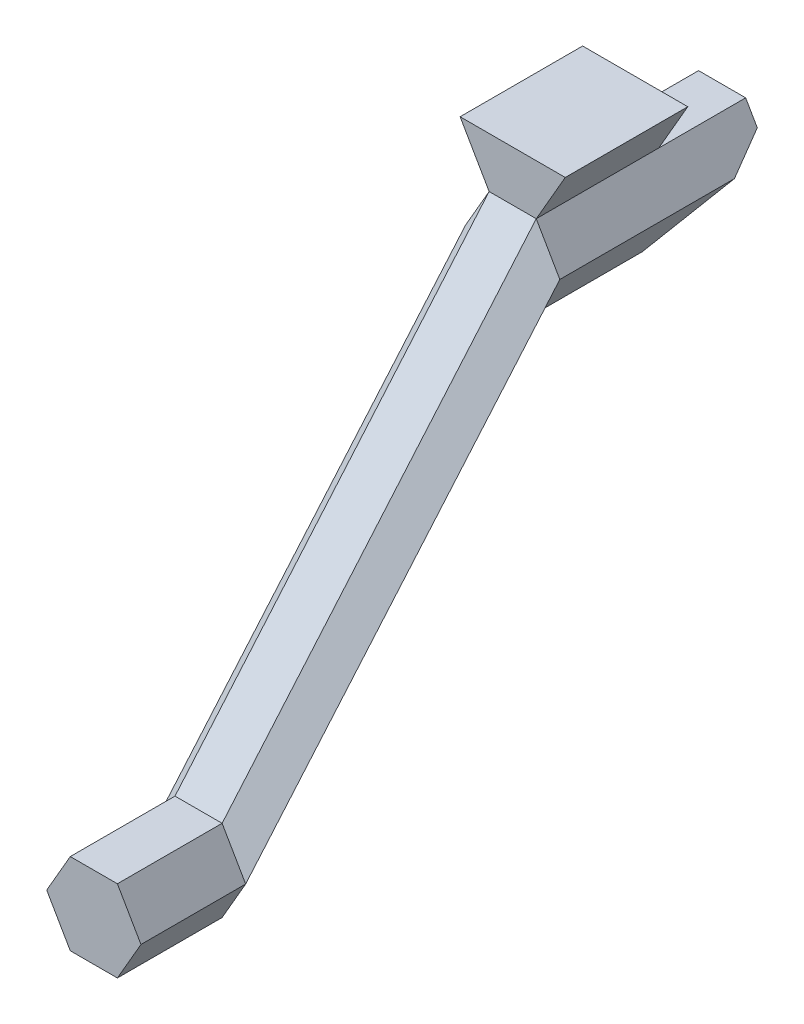
from build123d import *

# Parameters (mm, degrees)
BOSS_EXTRUDE1_DEPTH = 25.4
BOSS_EXTRUDE2_DEPTH = 12.7
BOSS_EXTRUDE3_DEPTH = 25.4
CHAMFER1_SIZE       = 7.46
CHAMFER1_SIZE2      = 12.54
CUT_EXTRUDE1_DEPTH  = 10.16
CHAMFER7_SIZE       = 0.381


with BuildPart() as part:
    # Sketch1 → Boss-Extrude1 (new body)
    with BuildSketch(Plane.XY):
        Polygon((5.715, 0), (2.8575, 4.949335183), (-2.8575, 4.949335183), (-5.715, 0), (-2.8575, -4.949335183), (2.8575, -4.949335183), align=None)
    extrude(amount=BOSS_EXTRUDE1_DEPTH)



with BuildPart() as body_2:
    # Sketch2 → Boss-Extrude2 (new body)
    with BuildSketch(Plane.XY.offset(63.5)):
        Polygon((-2.8575, -49.399335183), (2.8575, -49.399335183), (5.715, -44.45), (2.8575, -39.500664817), (-2.8575, -39.500664817), (-5.715, -44.45), align=None)
    extrude(amount=BOSS_EXTRUDE2_DEPTH)


with BuildPart() as part_1:
    add(part.part)

    add(body_2.part)  # loft1 joins it to this body
    # loft from a face of the part (loft1)
    loft([part_1.faces().sort_by_distance((0, 0, 25.4))[0], part_1.faces().sort_by_distance((0, -44.45, 63.5))[0]])

    # Sketch4 → Boss-Extrude3 (add)
    with BuildSketch(Plane(origin=(0, 0, 0), x_dir=(-1, 0, 0), z_dir=(0, 0, -1))):
        Polygon((2.8575, 4.949335183), (6.377027241, 11.045335183), (-6.377027241, 11.045335183), (-2.8575, 4.949335183), align=None)
    extrude(amount=-BOSS_EXTRUDE3_DEPTH)

    # Chamfer1
    chamfer1_edges = [part_1.edges().sort_by_distance(p)[0] for p in [
        (0, -4.949335183, 0),
    ]]
    chamfer1_side = [part_1.faces().sort_by_distance(p)[0] for p in [
        (0, 3.343943544, 0),
    ]]
    chamfer(chamfer1_edges, length=CHAMFER1_SIZE, length2=CHAMFER1_SIZE2, reference=chamfer1_side[0])

    # Sketch8 → Cut-Extrude1 (cut)
    with BuildSketch(Plane(origin=(0, 0, 0), x_dir=(-1, 0, 0), z_dir=(0, 0, -1))):
        Polygon((-6.377027241, 11.045335183), (6.377027241, 11.045335183), (2.8575, 4.949335183), (-2.8575, 4.949335183), align=None)
    extrude(amount=-CUT_EXTRUDE1_DEPTH, mode=Mode.SUBTRACT)

    # Chamfer7
    chamfer7_edges = [part_1.edges().sort_by_distance(p)[0] for p in [
        (4.61726362, 7.997335183, 10.16),
        (0, 11.045335183, 10.16),
        (-4.61726362, 7.997335183, 10.16),
    ]]
    chamfer(chamfer7_edges, length=CHAMFER7_SIZE)


solid = part_1.part
